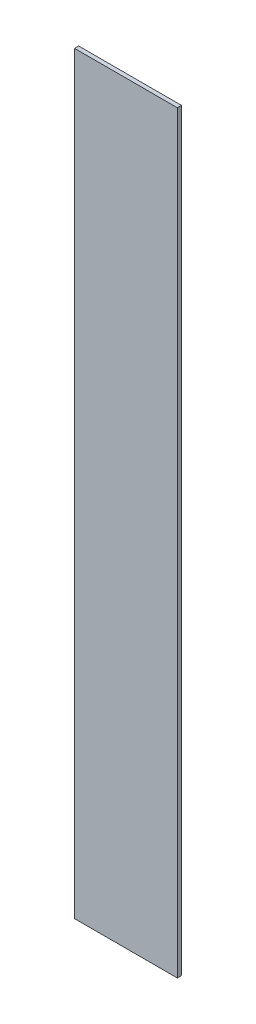
from build123d import *

# Parameters (mm, degrees)
ESBO_O1_W                = 30
ESBO_O1_H                = 220
RESSALTO_EXTRUS_O1_DEPTH = 1.2


with BuildPart() as part:
    # Esboço1 → Ressalto-extrusão1 (new body)
    with BuildSketch(Plane.XY):
        Rectangle(ESBO_O1_W, ESBO_O1_H)
    extrude(amount=RESSALTO_EXTRUS_O1_DEPTH)


solid = part.part
